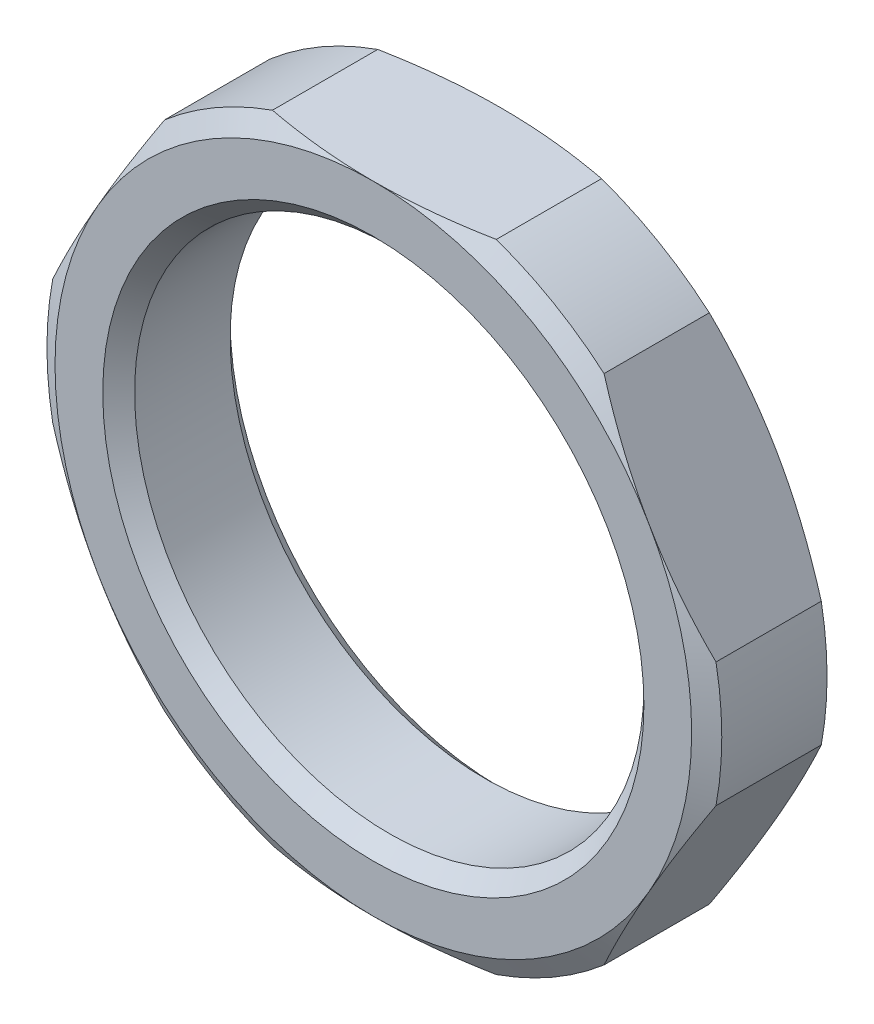
from build123d import *

# Parameters (mm, degrees)
HEX_SKETCH_R               = 4
HEX_2_DEPTH                = 1
HEX_CHAM_ID_SIZE           = 0.25
HEX_ROUND_DEPTH            = 8.702813339
HEX_ROUND_DEPTH_BACK       = 8.702813339
HEX_ROUND_SKETCH_OUTSIDE_W = 16.63
HEX_ROUND_SKETCH_OUTSIDE_H = 15.082
HEX_ROUND_SKETCH_OUTSIDE_R = 5.3


with BuildPart() as part:
    # Hex_Sketch → Hex 2 (new, symmetric)
    with BuildSketch(Plane.XY):
        Polygon((2.886751346, 5), (-2.886751346, 5), (-5.773502692, 0), (-2.886751346, -5), (2.886751346, -5), (5.773502692, 0), align=None)
        Circle(HEX_SKETCH_R, mode=Mode.SUBTRACT)
    extrude(amount=HEX_2_DEPTH, both=True)

    # Hex Cham OD_Sketch → Hex Cham OD (revolve, cut)
    with BuildSketch(Plane(origin=(0, 0, 0), x_dir=(1, 0, 0), z_dir=(0, 1, 0))):
        Polygon((-5.773502692, 1), (-5.773502692, 0.553418013), (-5, 1), align=None)
        Polygon((-5, -1), (-5.773502692, -1), (-5.773502692, -0.553418013), align=None)
    revolve(axis=Axis((0, 0, -5.304715554), (0, 0, 1)), mode=Mode.SUBTRACT)

    # Hex Cham ID
    hex_cham_id_edges = [part.edges().sort_by_distance(p)[0] for p in [
        (-4, 0, -1),
        (-4, 0, 1),
    ]]
    chamfer(hex_cham_id_edges, length=HEX_CHAM_ID_SIZE)

    # Hex Round_Sketch outside → Hex Round (cut, two sides: drawn at the far end of the back side and taken through both)
    with BuildSketch(Plane.XY.offset(-HEX_ROUND_DEPTH_BACK)):
        Rectangle(HEX_ROUND_SKETCH_OUTSIDE_W, HEX_ROUND_SKETCH_OUTSIDE_H)
        Circle(HEX_ROUND_SKETCH_OUTSIDE_R, mode=Mode.SUBTRACT)
    extrude(amount=HEX_ROUND_DEPTH + HEX_ROUND_DEPTH_BACK, mode=Mode.SUBTRACT)


solid = part.part
